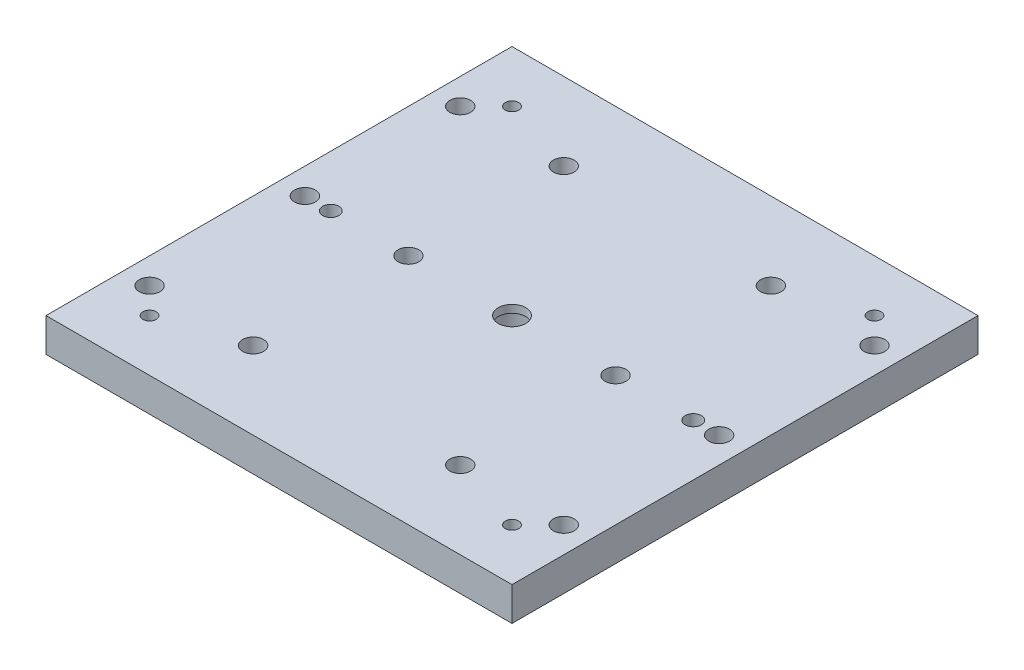
from build123d import *

# Parameters (mm, degrees)
SKETCH1_W                                        = 114.3
SKETCH1_H                                        = 114.3
STOCK_DEPTH                                      = 8.255
CBORE_FOR_1_4_SOCKET_HEAD_CAP_SCREW1_D           = 6.7564
CBORE_FOR_1_4_SOCKET_HEAD_CAP_SCREW1_CBORE_D     = 11.1125
CBORE_FOR_1_4_SOCKET_HEAD_CAP_SCREW1_CBORE_DEPTH = 6.35
F_5_32_0_15625_DIAMETER_HOLE1_D                  = 3.96875
CBORE_FOR_4_SOCKET_HEAD_CAP_SCREW1_D             = 3.2639
CBORE_FOR_4_SOCKET_HEAD_CAP_SCREW1_DEPTH         = 8.255
CBORE_FOR_4_SOCKET_HEAD_CAP_SCREW1_CBORE_D       = 5.55752
CBORE_FOR_4_SOCKET_HEAD_CAP_SCREW1_CBORE_DEPTH   = 2.8448
F_1_4_20_TAPPED_HOLE1_D                          = 5.1054


with BuildPart() as part:
    # Sketch1 → stock (new body)
    with BuildSketch(Plane(origin=(0, 0, 0), x_dir=(1, 0, 0), z_dir=(0, 1, 0))):
        Rectangle(SKETCH1_W, SKETCH1_H)
    extrude(amount=STOCK_DEPTH)

    # CBORE for 1/4 Socket Head Cap Screw1 (through all)
    with Locations(Plane(origin=(0, 0, 0), x_dir=(-1, 0, 0), z_dir=(0, -1, 0))):
        with Locations((0, 0)):
            CounterBoreHole(CBORE_FOR_1_4_SOCKET_HEAD_CAP_SCREW1_D / 2, CBORE_FOR_1_4_SOCKET_HEAD_CAP_SCREW1_CBORE_D / 2, CBORE_FOR_1_4_SOCKET_HEAD_CAP_SCREW1_CBORE_DEPTH)

    # 5/32 (0.15625) Diameter Hole1 (through all)
    with Locations(Plane(origin=(0, 8.255, 0), x_dir=(1, 0, 0), z_dir=(0, 1, 0))):
        with Locations((44.45, 0), (-44.45, 0)):
            Hole(F_5_32_0_15625_DIAMETER_HOLE1_D / 2)

    # CBORE for #4 Socket Head Cap Screw1
    with Locations(Plane(origin=(0, 0, 0), x_dir=(-1, 0, 0), z_dir=(0, -1, 0))):
        with Locations((44.45, -44.45), (44.45, 44.45), (-44.45, 44.45), (-44.45, -44.45), (0, 0)):
            CounterBoreHole(CBORE_FOR_4_SOCKET_HEAD_CAP_SCREW1_D / 2, CBORE_FOR_4_SOCKET_HEAD_CAP_SCREW1_CBORE_D / 2, CBORE_FOR_4_SOCKET_HEAD_CAP_SCREW1_CBORE_DEPTH, depth=CBORE_FOR_4_SOCKET_HEAD_CAP_SCREW1_DEPTH)

    # 1/4-20 Tapped Hole1 (through all)
    with Locations(Plane(origin=(0, 0, 0), x_dir=(-1, 0, 0), z_dir=(0, -1, 0))):
        with Locations((50.8, -38.1), (25.4, -38.1), (25.4, 0), (50.8, 0), (50.8, 38.1), (25.4, 38.1), (-25.4, 38.1), (-50.8, 38.1), (-50.8, 0), (-25.4, 0), (-25.4, -38.1), (-50.8, -38.1)):
            Hole(F_1_4_20_TAPPED_HOLE1_D / 2)


solid = part.part
